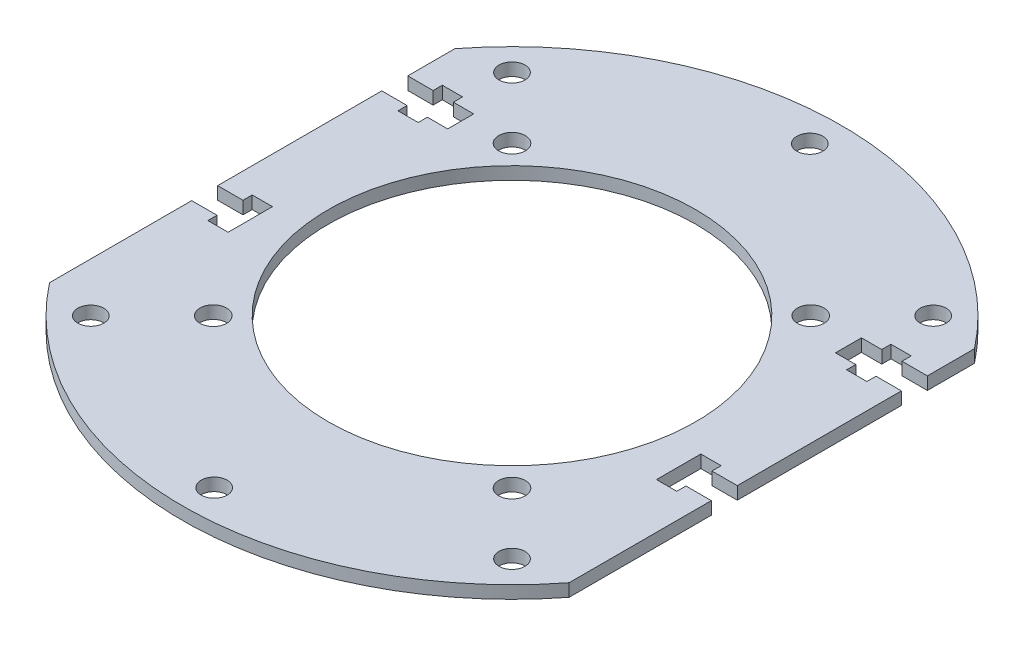
from build123d import *

# Parameters (mm, degrees)
SKETCH_1_R          = 52
SKETCH_1_R_2        = 29
SKETCH_1_R_3        = 2.05
SKETCH_1_R_4        = 2.1
EXTRUDE_1_DEPTH     = 2
SKETCH_2_W          = 182
SKETCH_2_H          = 210.035227354
SKETCH_2_W_2        = 82
SKETCH_2_H_2        = 110.035227354
CUT_EXTRUDE_1_DEPTH = 4


with BuildPart() as part:
    # 草图1 → 凸台-拉伸1 (new body)
    with BuildSketch(Plane(origin=(0, 0, 0), x_dir=(1, 0, 0), z_dir=(0, 1, 0))):
        with Locations(Location((0, 0, 0), (0, 0, 270))):
            Circle(SKETCH_1_R)
        with Locations(Location((0, 0, 0), (0, 0, 270))):
            Circle(SKETCH_1_R_2, mode=Mode.SUBTRACT)
        with Locations(Location((47, 0, 0), (0, 0, 270))):
            Circle(SKETCH_1_R_3, mode=Mode.SUBTRACT)
        with Locations(Location((33.234018716, -33.234018716, 0), (0, 0, 270))):
            Circle(SKETCH_1_R_3, mode=Mode.SUBTRACT)
        with Locations(Location((0, -47, 0), (0, 0, 270))):
            Circle(SKETCH_1_R_3, mode=Mode.SUBTRACT)
        with Locations(Location((-33.234018716, -33.234018716, 0), (0, 0, 270))):
            Circle(SKETCH_1_R_3, mode=Mode.SUBTRACT)
        with Locations(Location((-47, 0, 0), (0, 0, 270))):
            Circle(SKETCH_1_R_3, mode=Mode.SUBTRACT)
        with Locations(Location((-33.234018716, 33.234018716, 0), (0, 0, 270))):
            Circle(SKETCH_1_R_3, mode=Mode.SUBTRACT)
        with Locations(Location((0, 47, 0), (0, 0, 270))):
            Circle(SKETCH_1_R_3, mode=Mode.SUBTRACT)
        with Locations(Location((33.234018716, 33.234018716, 0), (0, 0, 270))):
            Circle(SKETCH_1_R_3, mode=Mode.SUBTRACT)
        with Locations(Location((-23.57, 23.57, 0), (0, 0, 270))):
            Circle(SKETCH_1_R_4, mode=Mode.SUBTRACT)
        with Locations(Location((-23.57, -23.57, 0), (0, 0, 270))):
            Circle(SKETCH_1_R_4, mode=Mode.SUBTRACT)
        with Locations(Location((23.57, -23.57, 0), (0, 0, 90))):
            Circle(SKETCH_1_R_4, mode=Mode.SUBTRACT)
        with Locations(Location((23.57, 23.57, 0), (0, 0, 90))):
            Circle(SKETCH_1_R_4, mode=Mode.SUBTRACT)
        Polygon((37, -9.55), (37, -11), (33.8, -11), (33.8, -9.55), (33.8, -5.45), (33.8, -4), (37, -4), (37, -5.45), (41, -5.45), (41, -9.55), align=None, mode=Mode.SUBTRACT)
        Polygon((37, 20.45), (37, 19), (33.8, 19), (33.8, 20.45), (30.6, 20.45), (30.6, 24.55), (33.8, 24.55), (33.8, 26), (37, 26), (37, 24.55), (41, 24.55), (41, 20.45), align=None, mode=Mode.SUBTRACT)
        Polygon((-33.8, 26), (-37, 26), (-37, 24.55), (-41, 24.55), (-41, 20.45), (-37, 20.45), (-37, 19), (-33.8, 19), (-33.8, 20.45), (-30.6, 20.45), (-30.6, 24.55), (-33.8, 24.55), align=None, mode=Mode.SUBTRACT)
        Polygon((-33.8, -4), (-37, -4), (-37, -5.45), (-41, -5.45), (-41, -9.55), (-37, -9.55), (-37, -11), (-33.8, -11), (-33.8, -9.55), (-33.8, -5.45), align=None, mode=Mode.SUBTRACT)
    extrude(amount=EXTRUDE_1_DEPTH)

    # 草图2 → 切除-拉伸-薄壁1 (cut)
    with BuildSketch(Plane(origin=(0, 2, 0), x_dir=(1, 0, 0), z_dir=(0, 1, 0))):
        Rectangle(SKETCH_2_W, SKETCH_2_H)
        Rectangle(SKETCH_2_W_2, SKETCH_2_H_2, mode=Mode.SUBTRACT)
    extrude(amount=-CUT_EXTRUDE_1_DEPTH, mode=Mode.SUBTRACT)


solid = part.part
